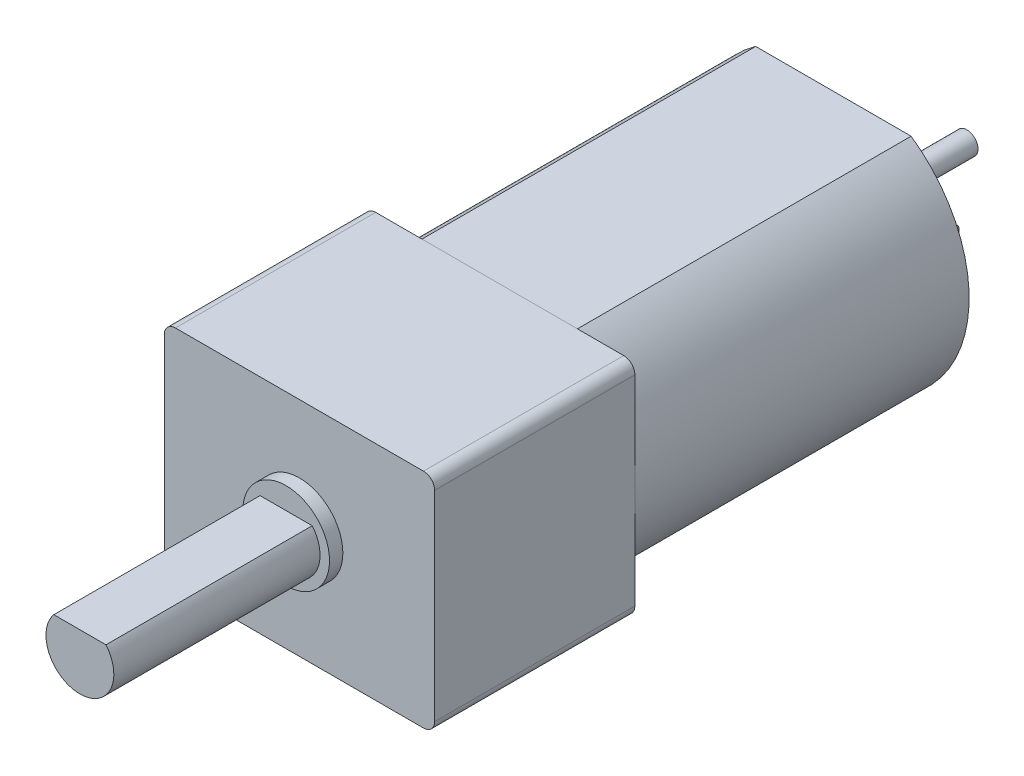
from build123d import *

# Parameters (mm, degrees)
SKETCH1_W            = 12.15
SKETCH1_H            = 10
EXTRUDE2_DEPTH       = 9
SKETCH11_R           = 1.95
EXTRUDE5_DEPTH       = 0.6
EXTRUDE6_DEPTH       = 9.27
EXTRUDE7_DEPTH       = 15
SKETCH14_R           = 2.5
EXTRUDE8_DEPTH       = 1.5
SKETCH16_W           = 0.3
SKETCH16_H           = 1.5
EXTRUDE10_DEPTH      = 2
FILLET1_R            = 0.3
FILLET2_R            = 0.5
FILLET3_R            = 0.3
SKETCH17_R           = 0.5
EXTRUDE11_DEPTH      = 4.5
FILLET1_OF_MIRROR2_R = 0.3


with BuildPart() as part:
    # Sketch1 → Extrude2 (new body)
    with BuildSketch(Plane.XY):
        Rectangle(SKETCH1_W, SKETCH1_H)
    extrude(amount=-EXTRUDE2_DEPTH)

    # Sketch11 → Extrude5 (add)
    with BuildSketch(Plane.XY):
        Circle(SKETCH11_R)
    extrude(amount=EXTRUDE5_DEPTH)

    # Sketch12 → Extrude6 (add)
    with BuildSketch(Plane.XY.offset(0.6)):
        with BuildLine():
            Line((-1.17260394, 0.975), (1.17260394, 0.975))
            ThreePointArc((1.17260394, 0.975), (0, -1.525), (-1.17260394, 0.975))
        make_face()
    extrude(amount=EXTRUDE6_DEPTH)

    # Fillet2
    fillet2_edges = [part.edges().sort_by_distance(p)[0] for p in [
        (-6.075, 5, -4.5),
        (6.075, 5, -4.5),
        (6.075, -5, -4.5),
        (-6.075, -5, -4.5),
    ]]
    fillet(fillet2_edges, radius=FILLET2_R)


with BuildPart() as body_2:
    # Sketch13 → Extrude7 (new body)
    with BuildSketch(Plane(origin=(0, 0, -9), x_dir=(-1, 0, 0), z_dir=(0, 0, -1))):
        with BuildLine():
            Line((-3.494281042, 5), (3.494281042, 5))
            ThreePointArc((3.494281042, 5), (6.1, 0), (3.494281042, -5))
            Line((3.494281042, -5), (-3.494281042, -5))
            ThreePointArc((-3.494281042, -5), (-6.1, 0), (-3.494281042, 5))
        make_face()
    extrude(amount=EXTRUDE7_DEPTH)

    # Sketch16 → Extrude10 (add)
    with BuildSketch(Plane(origin=(0, 0, -24), x_dir=(-1, 0, 0), z_dir=(0, 0, -1))):
        with Locations((3.5, 0)):
            Rectangle(SKETCH16_W, SKETCH16_H)
    extrude10 = extrude(amount=EXTRUDE10_DEPTH)

    # Fillet1
    fillet1_edges = [body_2.edges().sort_by_distance(p)[0] for p in [
        (-3.5, -0.75, -26),
        (-3.5, 0.75, -26),
    ]]
    fillet(fillet1_edges, radius=FILLET1_R)

    # Mirror2: Extrude10 across plane
    add(extrude10.mirror(Plane(origin=(0, 0, 0), x_dir=(0, 0, 1), z_dir=(1, 0, 0))))

    # Fillet1 of Mirror2
    fillet1_of_mirror2_edges = [body_2.edges().sort_by_distance(p)[0] for p in [
        (3.5, -0.75, -26),
        (3.5, 0.75, -26),
    ]]
    fillet(fillet1_of_mirror2_edges, radius=FILLET1_OF_MIRROR2_R)


with BuildPart() as body_3:
    # Sketch14 → Extrude8 (new body)
    with BuildSketch(Plane(origin=(0, 0, -24), x_dir=(-1, 0, 0), z_dir=(0, 0, -1))):
        Circle(SKETCH14_R)
    extrude(amount=EXTRUDE8_DEPTH)

    # Fillet3
    fillet3_edges = [body_3.edges().sort_by_distance(p)[0] for p in [
        (2.5, 0, -25.5),
    ]]
    fillet(fillet3_edges, radius=FILLET3_R)


with BuildPart() as body_4:
    # Sketch17 → Extrude11 (new body)
    with BuildSketch(Plane(origin=(0, 0, -25.5), x_dir=(-1, 0, 0), z_dir=(0, 0, -1))):
        Circle(SKETCH17_R)
    extrude(amount=EXTRUDE11_DEPTH)


solid = Compound([part.part, body_2.part, body_3.part, body_4.part])
